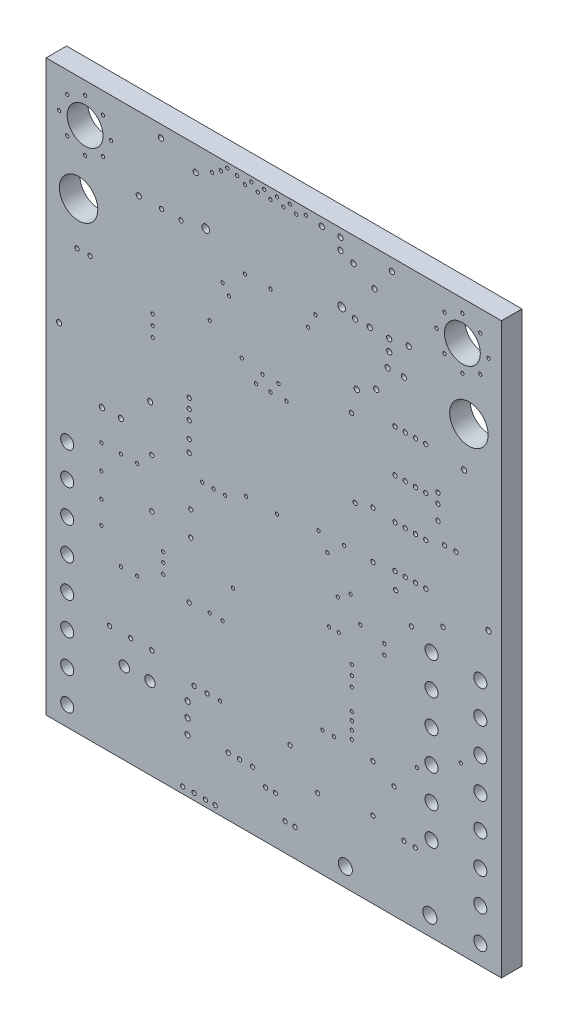
from build123d import *

# Parameters (mm, degrees)
SKETCH1_W           = 35.56
SKETCH1_H           = 44.45
BOARD_OUTLINE_DEPTH = 1.6
SKETCH2_R           = 0.3
SKETCH2_R_2         = 0.127
SKETCH2_R_3         = 0.1651
SKETCH2_R_4         = 0.2032
NPTH_DEPTH          = 57.946256242
SKETCH3_R           = 1.4
SKETCH3_R_2         = 0.51
SKETCH3_R_3         = 1.5
SKETCH3_R_4         = 0.55
SKETCH3_R_5         = 0.4
PTH_DEPTH           = 57.946256242


with BuildPart() as part:
    # Sketch1 → Board_Outline (new body)
    with BuildSketch(Plane.XY):
        with Locations((17.78, 22.225)):
            Rectangle(SKETCH1_W, SKETCH1_H)
    extrude(amount=BOARD_OUTLINE_DEPTH)

    # Sketch2 → NPTH (cut, through all)
    with BuildSketch(Plane.XY):
        with Locations((23.08, 39.14)):
            Circle(SKETCH2_R)
        with Locations((12.48, 39.14)):
            Circle(SKETCH2_R)
        with Locations((32.385, 12.954)):
            Circle(SKETCH2_R_2)
        with Locations((15.621, 22.606)):
            Circle(SKETCH2_R_2)
        with Locations((28.848, 23.368)):
            Circle(SKETCH2_R_3)
        with Locations((13.589, 7.747)):
            Circle(SKETCH2_R_2)
        with Locations((19.53, 43.6372)):
            Circle(SKETCH2_R_2)
        with Locations((24.543, 18.383)):
            Circle(SKETCH2_R_2)
        with Locations((16.395, 30.607)):
            Circle(SKETCH2_R_2)
        with Locations((22.098, 17.018)):
            Circle(SKETCH2_R_2)
        with Locations((16.895, 31.496)):
            Circle(SKETCH2_R_2)
        with Locations((22.86, 17.018)):
            Circle(SKETCH2_R_2)
        with Locations((12.78, 33.067)):
            Circle(SKETCH2_R_2)
        with Locations((15.53, 43.6372)):
            Circle(SKETCH2_R_2)
        with Locations((12.192, 21.844)):
            Circle(SKETCH2_R_2)
        with Locations((16.03, 44.069)):
            Circle(SKETCH2_R_2)
        with Locations((13.081, 21.844)):
            Circle(SKETCH2_R_2)
        with Locations((16.53, 43.6372)):
            Circle(SKETCH2_R_2)
        with Locations((13.97, 21.844)):
            Circle(SKETCH2_R_2)
        with Locations((17.03, 44.069)):
            Circle(SKETCH2_R_2)
        with Locations((18.149, 31.496)):
            Circle(SKETCH2_R_2)
        with Locations((18.03, 44.069)):
            Circle(SKETCH2_R_2)
        with Locations((12.78, 13.288)):
            Circle(SKETCH2_R_2)
        with Locations((19.03, 44.069)):
            Circle(SKETCH2_R_2)
        with Locations((13.78, 13.272)):
            Circle(SKETCH2_R_2)
        with Locations((17.526, 30.607)):
            Circle(SKETCH2_R_2)
        with Locations((18.034, 22.606)):
            Circle(SKETCH2_R_2)
        with Locations((18.776, 30.627)):
            Circle(SKETCH2_R_2)
        with Locations((22.781, 19.383)):
            Circle(SKETCH2_R_2)
        with Locations((15.28, 31.79)):
            Circle(SKETCH2_R_2)
        with Locations((18.53, 43.6372)):
            Circle(SKETCH2_R_2)
        with Locations((4.318, 20.574)):
            Circle(SKETCH2_R_2)
        with Locations((4.318, 16.764)):
            Circle(SKETCH2_R_2)
        with Locations((8.255, 21.717)):
            Circle(SKETCH2_R_3)
        with Locations((5.842, 20.574)):
            Circle(SKETCH2_R_2)
        with Locations((7.112, 12.954)):
            Circle(SKETCH2_R_2)
        with Locations((30.988, 21.463)):
            Circle(SKETCH2_R_3)
        with Locations((27.305, 22.098)):
            Circle(SKETCH2_R_3)
        with Locations((4.318, 18.669)):
            Circle(SKETCH2_R_2)
        with Locations((4.318, 14.986)):
            Circle(SKETCH2_R_2)
        with Locations((30.607, 30.353)):
            Circle(SKETCH2_R_3)
        with Locations((28.829, 5.461)):
            Circle(SKETCH2_R_3)
        with Locations((27.94, 5.461)):
            Circle(SKETCH2_R_3)
        with Locations((5.842, 12.954)):
            Circle(SKETCH2_R_2)
        with Locations((11.303, 17.653)):
            Circle(SKETCH2_R_3)
        with Locations((7.112, 20.574)):
            Circle(SKETCH2_R_2)
        with Locations((11.176, 26.289)):
            Circle(SKETCH2_R_3)
        with Locations((11.176, 27.051)):
            Circle(SKETCH2_R_3)
        with Locations((6.604, 8.509)):
            Circle(SKETCH2_R_3)
        with Locations((8.255, 8.509)):
            Circle(SKETCH2_R_3)
        with Locations((19.05, 7.493)):
            Circle(SKETCH2_R_3)
        with Locations((1.016, 27.051)):
            Circle(SKETCH2_R_4)
        with Locations((4.3688, 22.987)):
            Circle(SKETCH2_R_4)
        with Locations((25.527, 26.797)):
            Circle(SKETCH2_R_3)
        with Locations((25.527, 5.969)):
            Circle(SKETCH2_R_3)
        with Locations((30.607, 29.591)):
            Circle(SKETCH2_R_3)
        with Locations((11.176, 13.208)):
            Circle(SKETCH2_R_3)
        with Locations((11.176, 25.527)):
            Circle(SKETCH2_R_3)
        with Locations((15.113, 4.572)):
            Circle(SKETCH2_R_3)
        with Locations((14.224, 4.572)):
            Circle(SKETCH2_R_3)
        with Locations((16.129, 4.572)):
            Circle(SKETCH2_R_3)
        with Locations((11.557, 7.747)):
            Circle(SKETCH2_R_3)
        with Locations((24.13, 26.416)):
            Circle(SKETCH2_R_3)
        with Locations((34.544, 22.987)):
            Circle(SKETCH2_R_4)
        with Locations((28.525, 20.27)):
            Circle(SKETCH2_R_3)
        with Locations((28.848, 26.67)):
            Circle(SKETCH2_R_3)
        with Locations((32.648, 32.902)):
            Circle(SKETCH2_R_4)
        with Locations((23.85, 32.359)):
            Circle(SKETCH2_R_3)
        with Locations((17.907, 3.683)):
            Circle(SKETCH2_R_3)
        with Locations((17.145, 3.683)):
            Circle(SKETCH2_R_3)
        with Locations((11.049, 5.334)):
            Circle(SKETCH2_R_4)
        with Locations((25.781, 34.925)):
            Circle(SKETCH2_R_4)
        with Locations((27.94, 36.83)):
            Circle(SKETCH2_R_4)
        with Locations((26.67, 36.83)):
            Circle(SKETCH2_R_4)
        with Locations((25.654, 41.656)):
            Circle(SKETCH2_R_4)
        with Locations((24.257, 34.163)):
            Circle(SKETCH2_R_4)
        with Locations((17.53, 37.592)):
            Circle(SKETCH2_R_2)
        with Locations((15.53, 37.592)):
            Circle(SKETCH2_R_2)
        with Locations((21.03, 37.592)):
            Circle(SKETCH2_R_2)
        with Locations((11.049, 4.191)):
            Circle(SKETCH2_R_4)
        with Locations((11.049, 6.477)):
            Circle(SKETCH2_R_4)
        with Locations((14.28, 35.489)):
            Circle(SKETCH2_R_2)
        with Locations((14.149, 44.069)):
            Circle(SKETCH2_R_2)
        with Locations((13.78, 36.132)):
            Circle(SKETCH2_R_2)
        with Locations((13.649, 43.6372)):
            Circle(SKETCH2_R_2)
        with Locations((21.59, 9.779)):
            Circle(SKETCH2_R_2)
        with Locations((22.479, 9.779)):
            Circle(SKETCH2_R_2)
        with Locations((9.144, 14.097)):
            Circle(SKETCH2_R_2)
        with Locations((8.325, 29.699)):
            Circle(SKETCH2_R_2)
        with Locations((8.325, 30.499)):
            Circle(SKETCH2_R_2)
        with Locations((9.144, 14.883)):
            Circle(SKETCH2_R_2)
        with Locations((9.144, 15.621)):
            Circle(SKETCH2_R_2)
        with Locations((8.325, 31.299)):
            Circle(SKETCH2_R_2)
        with Locations((3.048, 43.434)):
            Circle(SKETCH2_R_2)
        with Locations((5.08, 41.402)):
            Circle(SKETCH2_R_2)
        with Locations((5.842, 22.987)):
            Circle(SKETCH2_R_4)
        with Locations((7.239, 38.735)):
            Circle(SKETCH2_R_4)
        with Locations((1.016, 41.402)):
            Circle(SKETCH2_R_2)
        with Locations((3.048, 39.37)):
            Circle(SKETCH2_R_2)
        with Locations((8.966, 43.51)):
            Circle(SKETCH2_R_4)
        with Locations((27, 43.51)):
            Circle(SKETCH2_R_4)
        with Locations((24.003, 42.545)):
            Circle(SKETCH2_R_4)
        with Locations((11.684, 42.545)):
            Circle(SKETCH2_R_4)
        with Locations((4.445, 42.799)):
            Circle(SKETCH2_R_2)
        with Locations((1.651, 42.799)):
            Circle(SKETCH2_R_2)
        with Locations((1.651, 40.005)):
            Circle(SKETCH2_R_2)
        with Locations((4.445, 40.005)):
            Circle(SKETCH2_R_2)
        with Locations((32.512, 43.434)):
            Circle(SKETCH2_R_2)
        with Locations((30.48, 41.402)):
            Circle(SKETCH2_R_2)
        with Locations((34.544, 41.402)):
            Circle(SKETCH2_R_2)
        with Locations((32.512, 39.37)):
            Circle(SKETCH2_R_2)
        with Locations((31.115, 42.799)):
            Circle(SKETCH2_R_2)
        with Locations((31.115, 40.005)):
            Circle(SKETCH2_R_2)
        with Locations((33.909, 42.799)):
            Circle(SKETCH2_R_2)
        with Locations((33.909, 40.005)):
            Circle(SKETCH2_R_2)
        with Locations((29.648, 23.368)):
            Circle(SKETCH2_R_3)
        with Locations((14.597, 15.883)):
            Circle(SKETCH2_R_2)
        with Locations((30.607, 28.448)):
            Circle(SKETCH2_R_3)
        with Locations((29.648, 29.845)):
            Circle(SKETCH2_R_3)
        with Locations((26.416, 17.272)):
            Circle(SKETCH2_R_2)
        with Locations((28.848, 29.845)):
            Circle(SKETCH2_R_3)
        with Locations((26.416, 18.034)):
            Circle(SKETCH2_R_2)
        with Locations((28.048, 29.845)):
            Circle(SKETCH2_R_3)
        with Locations((27.248, 26.67)):
            Circle(SKETCH2_R_3)
        with Locations((28.048, 26.67)):
            Circle(SKETCH2_R_3)
        with Locations((27.248, 29.845)):
            Circle(SKETCH2_R_3)
        with Locations((21.28, 23.114)):
            Circle(SKETCH2_R_2)
        with Locations((23.876, 11.557)):
            Circle(SKETCH2_R_2)
        with Locations((23.876, 12.192)):
            Circle(SKETCH2_R_2)
        with Locations((23.876, 10.287)):
            Circle(SKETCH2_R_2)
        with Locations((23.876, 10.922)):
            Circle(SKETCH2_R_2)
        with Locations((21.971, 21.971)):
            Circle(SKETCH2_R_2)
        with Locations((23.28, 23.114)):
            Circle(SKETCH2_R_2)
        with Locations((20.447, 36.449)):
            Circle(SKETCH2_R_2)
        with Locations((23.78, 20.066)):
            Circle(SKETCH2_R_2)
        with Locations((23.876, 13.843)):
            Circle(SKETCH2_R_2)
        with Locations((23.876, 14.605)):
            Circle(SKETCH2_R_2)
        with Locations((28.956, 10.922)):
            Circle(SKETCH2_R_2)
        with Locations((23.876, 15.367)):
            Circle(SKETCH2_R_2)
        with Locations((21.209, 5.334)):
            Circle(SKETCH2_R_3)
        with Locations((27.178, 8.763)):
            Circle(SKETCH2_R_3)
        with Locations((11.303, 19.558)):
            Circle(SKETCH2_R_3)
        with Locations((25.527, 23.114)):
            Circle(SKETCH2_R_3)
        with Locations((11.176, 24.257)):
            Circle(SKETCH2_R_3)
        with Locations((8.255, 17.907)):
            Circle(SKETCH2_R_3)
        with Locations((3.429, 32.766)):
            Circle(SKETCH2_R_3)
        with Locations((11.176, 23.33)):
            Circle(SKETCH2_R_3)
        with Locations((4.953, 8.509)):
            Circle(SKETCH2_R_3)
        with Locations((25.527, 9.652)):
            Circle(SKETCH2_R_3)
        with Locations((2.413, 32.766)):
            Circle(SKETCH2_R_3)
        with Locations((28.321, 39.116)):
            Circle(SKETCH2_R_4)
        with Locations((8.128, 25.273)):
            Circle(SKETCH2_R_4)
        with Locations((12.573, 7.747)):
            Circle(SKETCH2_R_3)
        with Locations((28.048, 23.368)):
            Circle(SKETCH2_R_3)
        with Locations((27.248, 23.368)):
            Circle(SKETCH2_R_3)
        with Locations((29.648, 26.67)):
            Circle(SKETCH2_R_3)
        with Locations((27.248, 33.147)):
            Circle(SKETCH2_R_3)
        with Locations((29.648, 33.147)):
            Circle(SKETCH2_R_3)
        with Locations((28.048, 33.147)):
            Circle(SKETCH2_R_3)
        with Locations((28.848, 33.147)):
            Circle(SKETCH2_R_3)
        with Locations((25.273, 38.862)):
            Circle(SKETCH2_R_4)
        with Locations((24.13, 38.862)):
            Circle(SKETCH2_R_4)
        with Locations((22.987, 43.815)):
            Circle(SKETCH2_R_4)
        with Locations((22.987, 42.926)):
            Circle(SKETCH2_R_4)
        with Locations((31.115, 27.051)):
            Circle(SKETCH2_R_3)
        with Locations((32.004, 27.051)):
            Circle(SKETCH2_R_3)
        with Locations((12.954, 43.18)):
            Circle(SKETCH2_R_2)
        with Locations((14.903, 43.942)):
            Circle(SKETCH2_R_2)
        with Locations((17.53, 43.6372)):
            Circle(SKETCH2_R_2)
        with Locations((20.284, 43.942)):
            Circle(SKETCH2_R_2)
        with Locations((9.017, 38.735)):
            Circle(SKETCH2_R_3)
        with Locations((10.541, 38.735)):
            Circle(SKETCH2_R_3)
        with Locations((13.208, 0.508)):
            Circle(SKETCH2_R_3)
        with Locations((12.446, 0.508)):
            Circle(SKETCH2_R_3)
        with Locations((11.557, 0.508)):
            Circle(SKETCH2_R_3)
        with Locations((10.668, 0.508)):
            Circle(SKETCH2_R_3)
        with Locations((26.797, 37.973)):
            Circle(SKETCH2_R_4)
        with Locations((26.797, 38.862)):
            Circle(SKETCH2_R_4)
        with Locations((21.53, 43.8185)):
            Circle(SKETCH2_R_4)
        with Locations((18.669, 2.159)):
            Circle(SKETCH2_R_3)
        with Locations((19.431, 2.159)):
            Circle(SKETCH2_R_3)
    extrude(amount=NPTH_DEPTH, mode=Mode.SUBTRACT)

    # Sketch3 → PTH (cut, through all)
    with BuildSketch(Plane.XY):
        with Locations((3.05, 41.4)):
            Circle(SKETCH3_R)
        with Locations((32.51, 41.4)):
            Circle(SKETCH3_R)
        with Locations((1.65, 19.3)):
            Circle(SKETCH3_R_2)
        with Locations((1.65, 16.76)):
            Circle(SKETCH3_R_2)
        with Locations((1.65, 14.22)):
            Circle(SKETCH3_R_2)
        with Locations((1.65, 11.68)):
            Circle(SKETCH3_R_2)
        with Locations((1.65, 9.14)):
            Circle(SKETCH3_R_2)
        with Locations((1.65, 6.6)):
            Circle(SKETCH3_R_2)
        with Locations((1.65, 4.06)):
            Circle(SKETCH3_R_2)
        with Locations((1.65, 1.52)):
            Circle(SKETCH3_R_2)
        with Locations((33.91, 19.3)):
            Circle(SKETCH3_R_2)
        with Locations((33.91, 16.76)):
            Circle(SKETCH3_R_2)
        with Locations((33.91, 14.22)):
            Circle(SKETCH3_R_2)
        with Locations((33.91, 11.68)):
            Circle(SKETCH3_R_2)
        with Locations((33.91, 9.14)):
            Circle(SKETCH3_R_2)
        with Locations((33.91, 6.6)):
            Circle(SKETCH3_R_2)
        with Locations((33.91, 4.06)):
            Circle(SKETCH3_R_2)
        with Locations((33.91, 1.52)):
            Circle(SKETCH3_R_2)
        with Locations((30.1, 19.3)):
            Circle(SKETCH3_R_2)
        with Locations((30.1, 16.76)):
            Circle(SKETCH3_R_2)
        with Locations((30.1, 14.22)):
            Circle(SKETCH3_R_2)
        with Locations((30.1, 11.68)):
            Circle(SKETCH3_R_2)
        with Locations((30.1, 9.14)):
            Circle(SKETCH3_R_2)
        with Locations((30.1, 6.6)):
            Circle(SKETCH3_R_2)
        with Locations((2.54, 36.2)):
            Circle(SKETCH3_R_3)
        with Locations((33.02, 36.2)):
            Circle(SKETCH3_R_3)
        with Locations((23.37, 1.45)):
            Circle(SKETCH3_R_4)
        with Locations((29.97, 1.45)):
            Circle(SKETCH3_R_4)
        with Locations((6.11, 6.35)):
            Circle(SKETCH3_R_5)
        with Locations((8.11, 6.35)):
            Circle(SKETCH3_R_5)
    extrude(amount=PTH_DEPTH, mode=Mode.SUBTRACT)


solid = part.part
